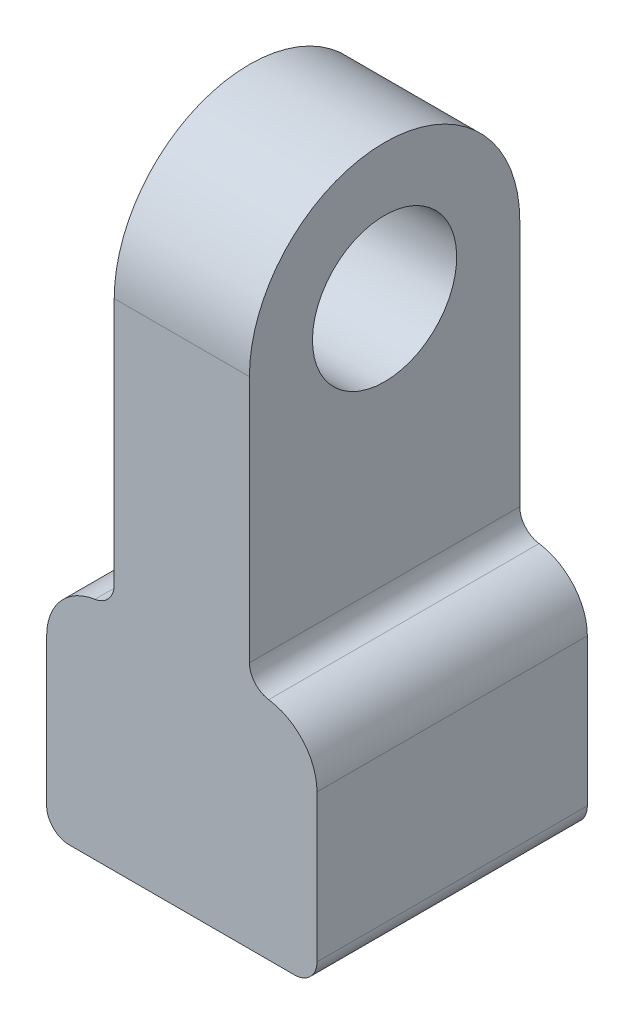
from build123d import *

# Parameters (mm, degrees)
EXTRUDE_1_DEPTH     = 3
FILLET_1_R          = 0.5
FILLET_2_R          = 1.25
SKETCH_3_R          = 1.6
CUT_EXTRUDE_2_DEPTH = 16.008331163
SKETCH_4_R          = 2.05
CUT_EXTRUDE_4_DEPTH = 4
CUT_EXTRUDE_5_DEPTH = 16.008331163


with BuildPart() as part:
    # ｽｹｯﾁ1 → ﾎﾞｽ - 押し出し1 (new, symmetric)
    with BuildSketch(Plane.XY):
        Polygon((1.5, 14), (-1.5, 14), (-1.5, 5), (-3, 5), (-3, 0), (3, 0), (3, 5), (1.5, 5), align=None)
    extrude(amount=EXTRUDE_1_DEPTH, both=True)

    # ﾌｨﾚｯﾄ1
    fillet_1_edges = [part.edges().sort_by_distance(p)[0] for p in [
        (1.5, 5, 0),
        (3, 0, 0),
        (-3, 0, 0),
        (-1.5, 5, 0),
    ]]
    fillet(fillet_1_edges, radius=FILLET_1_R)

    # ﾌｨﾚｯﾄ2
    fillet_2_edges = [part.edges().sort_by_distance(p)[0] for p in [
        (3, 5, 0),
        (-3, 5, 0),
    ]]
    fillet(fillet_2_edges, radius=FILLET_2_R)

    # ｽｹｯﾁ3 → ｶｯﾄ - 押し出し2 (cut, through all)
    with BuildSketch(Plane.ZY.offset(1.5)):
        with Locations(Location((0, 11, 0), (0, 0, 270))):
            Circle(SKETCH_3_R)
    extrude(amount=-CUT_EXTRUDE_2_DEPTH, mode=Mode.SUBTRACT)

    # ｽｹｯﾁ4 → ｶｯﾄ - 押し出し4 (cut)
    with BuildSketch(Plane.XZ):
        with Locations(Location((0, 0, 0), (0, 0, 270))):
            Circle(SKETCH_4_R)
    extrude(amount=-CUT_EXTRUDE_4_DEPTH, mode=Mode.SUBTRACT)

    # ｽｹｯﾁ5 → ｶｯﾄ - 押し出し5 (cut, through all)
    with BuildSketch(Plane.ZY.offset(1.5)):
        with BuildLine():
            Line((-3, 14), (-3, 11))
            ThreePointArc((-3, 11), (-2.121320344, 13.121320344), (0, 14))
            Line((0, 14), (-3, 14))
        make_face()
        with BuildLine():
            Line((3, 14), (0, 14))
            ThreePointArc((0, 14), (2.121320344, 13.121320344), (3, 11))
            Line((3, 11), (3, 14))
        make_face()
    extrude(amount=-CUT_EXTRUDE_5_DEPTH, mode=Mode.SUBTRACT)


solid = part.part
